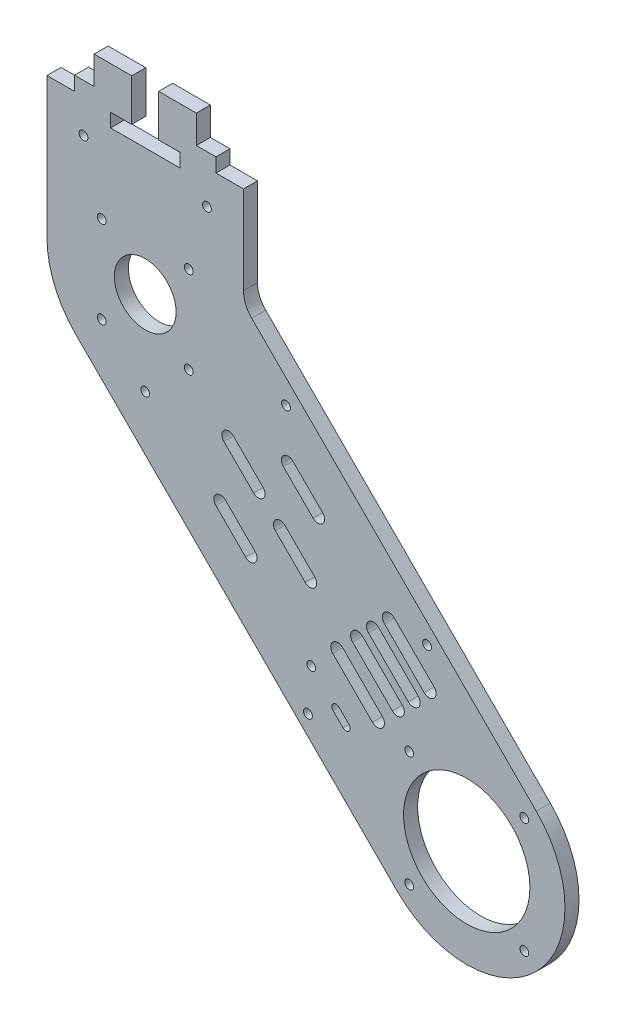
from build123d import *

# Parameters (mm, degrees)
SKETCH1_R           = 1.575
SKETCH1_R_2         = 22.5
SKETCH1_R_3         = 11
BOSS_EXTRUDE1_DEPTH = 5
SKETCH2_W           = 13.4
SKETCH2_H           = 5
BOSS_EXTRUDE2_DEPTH = 5


with BuildPart() as part:
    # Sketch1 → Boss-Extrude1 (new body)
    with BuildSketch(Plane.XY):
        with BuildLine():
            Line((-139.300035894, 89.802561211), (-24.748737342, -24.748737342))
            ThreePointArc((-24.748737342, -24.748737342), (24.748737342, -24.748737342), (24.748737342, 24.748737342))
            Line((24.748737342, 24.748737342), (-54.672802234, 104.170276917))
            Line((-54.672802234, 104.170276917), (-76.622366364, 126.119841047))
            ThreePointArc((-76.622366364, 126.119841047), (-78.790093877, 129.364074535), (-79.551298552, 133.190908859))
            Line((-79.551298552, 133.190908859), (-79.551298552, 164.551298552))
            Line((-79.551298552, 164.551298552), (-89.351298552, 164.551298552))
            Line((-89.351298552, 164.551298552), (-89.351298552, 169.551298552))
            Line((-89.351298552, 169.551298552), (-96.351298552, 169.551298552))
            Line((-96.351298552, 169.551298552), (-96.351298552, 174.551298552))
            Line((-96.351298552, 174.551298552), (-109.751298552, 174.551298552))
            Line((-109.751298552, 174.551298552), (-109.751298552, 169.551298552))
            Line((-109.751298552, 169.551298552), (-109.751298552, 164.551298552))
            Line((-109.751298552, 164.551298552), (-102.201298552, 164.551298552))
            Line((-102.201298552, 164.551298552), (-102.201298552, 159.701298552))
            Line((-102.201298552, 159.701298552), (-126.901298552, 159.701298552))
            Line((-126.901298552, 159.701298552), (-126.901298552, 164.551298552))
            Line((-126.901298552, 164.551298552), (-119.351298552, 164.551298552))
            Line((-119.351298552, 164.551298552), (-119.351298552, 169.551298552))
            Line((-119.351298552, 169.551298552), (-119.351298552, 174.551298552))
            Line((-119.351298552, 174.551298552), (-132.751298552, 174.551298552))
            Line((-132.751298552, 174.551298552), (-132.751298552, 169.551298552))
            Line((-132.751298552, 169.551298552), (-139.751298552, 169.551298552))
            Line((-139.751298552, 169.551298552), (-139.751298552, 164.551298552))
            Line((-139.751298552, 164.551298552), (-149.551298552, 164.551298552))
            Line((-149.551298552, 164.551298552), (-149.551298552, 114.551298552))
            ThreePointArc((-149.551298552, 114.551298552), (-146.88708219, 101.157378419), (-139.300035894, 89.802561211))
        make_face()
        with BuildLine():
            Line((-78.771695424, 51.335952314), (-89.378297142, 61.942554032))
            ThreePointArc((-89.378297142, 61.942554032), (-89.378297142, 65.336666582), (-85.984184592, 65.336666582))
            Line((-85.984184592, 65.336666582), (-75.377582874, 54.730064864))
            ThreePointArc((-75.377582874, 54.730064864), (-75.377582874, 51.335952314), (-78.771695424, 51.335952314))
        make_face(mode=Mode.SUBTRACT)
        with BuildLine():
            ThreePointArc((-68.165093707, 64.770981156), (-68.165093707, 68.165093706), (-64.770981157, 68.165093706))
            Line((-64.770981157, 68.165093706), (-54.164379439, 57.558491989))
            ThreePointArc((-54.164379439, 57.558491989), (-54.164379439, 54.164379439), (-57.558491988, 54.164379439))
            Line((-57.558491988, 54.164379439), (-68.165093707, 64.770981156))
        make_face(mode=Mode.SUBTRACT)
        with Locations((-20.506096654, -20.506096654)):
            Circle(SKETCH1_R, mode=Mode.SUBTRACT)
        with Locations((-56.568542495, 14.142135624)):
            Circle(SKETCH1_R, mode=Mode.SUBTRACT)
        with Locations((20.506096654, -20.506096654)):
            Circle(SKETCH1_R, mode=Mode.SUBTRACT)
        Circle(SKETCH1_R_2, mode=Mode.SUBTRACT)
        with Locations((-55.401816306, 29.450997436)):
            Circle(SKETCH1_R, mode=Mode.SUBTRACT)
        with BuildLine():
            ThreePointArc((-47.623641713, 19.5515025), (-47.623641713, 21.672822843), (-45.502321369, 21.672822843))
            Line((-45.502321369, 21.672822843), (-41.966787463, 18.137288937))
            ThreePointArc((-41.966787463, 18.137288937), (-41.966787463, 16.015968594), (-44.088107807, 16.015968594))
            Line((-44.088107807, 16.015968594), (-47.623641713, 19.5515025))
        make_face(mode=Mode.SUBTRACT)
        with BuildLine():
            ThreePointArc((-47.72970773, 37.123106012), (-47.72970773, 40.658639918), (-44.194173824, 40.658639918))
            Line((-44.194173824, 40.658639918), (-30.0520382, 26.516504294))
            ThreePointArc((-30.0520382, 26.516504294), (-30.0520382, 22.980970389), (-33.587572106, 22.980970389))
            Line((-33.587572106, 22.980970389), (-47.72970773, 37.123106012))
        make_face(mode=Mode.SUBTRACT)
        with Locations((-20.506096654, 20.506096654)):
            Circle(SKETCH1_R, mode=Mode.SUBTRACT)
        with BuildLine():
            ThreePointArc((-40.658639918, 44.194173824), (-40.658639918, 47.72970773), (-37.123106012, 47.72970773))
            Line((-37.123106012, 47.72970773), (-22.980970389, 33.587572106))
            ThreePointArc((-22.980970389, 33.587572106), (-22.980970389, 30.0520382), (-26.516504294, 30.0520382))
            Line((-26.516504294, 30.0520382), (-40.658639918, 44.194173824))
        make_face(mode=Mode.SUBTRACT)
        with BuildLine():
            ThreePointArc((-35.001785669, 49.851028074), (-35.001785669, 53.38656198), (-31.466251763, 53.38656198))
            Line((-31.466251763, 53.38656198), (-17.324116139, 39.244426356))
            ThreePointArc((-17.324116139, 39.244426356), (-17.324116139, 35.70889245), (-20.859650045, 35.70889245))
            Line((-20.859650045, 35.70889245), (-35.001785669, 49.851028074))
        make_face(mode=Mode.SUBTRACT)
        with BuildLine():
            ThreePointArc((-29.344931419, 55.507882323), (-29.344931419, 59.043416229), (-25.809397513, 59.043416229))
            Line((-25.809397513, 59.043416229), (-11.66726189, 44.901280605))
            ThreePointArc((-11.66726189, 44.901280605), (-11.66726189, 41.365746699), (-15.202795796, 41.365746699))
            Line((-15.202795796, 41.365746699), (-29.344931419, 55.507882323))
        make_face(mode=Mode.SUBTRACT)
        with Locations((-14.142135624, 56.568542495)):
            Circle(SKETCH1_R, mode=Mode.SUBTRACT)
        with Locations((20.506096654, 20.506096654)):
            Circle(SKETCH1_R, mode=Mode.SUBTRACT)
        with Locations((-114.551298552, 84.551298552)):
            Circle(SKETCH1_R, mode=Mode.SUBTRACT)
        with Locations((-130.051298552, 99.051298552)):
            Circle(SKETCH1_R, mode=Mode.SUBTRACT)
        with Locations((-114.551298552, 114.551298552)):
            Circle(SKETCH1_R_3, mode=Mode.SUBTRACT)
        with BuildLine():
            ThreePointArc((-86.549870017, 83.155757468), (-86.549870017, 86.549870017), (-83.155757468, 86.549870017))
            Line((-83.155757468, 86.549870017), (-72.54915575, 75.943268299))
            ThreePointArc((-72.54915575, 75.943268299), (-72.54915575, 72.54915575), (-75.943268299, 72.54915575))
            Line((-75.943268299, 72.54915575), (-86.549870017, 83.155757468))
        make_face(mode=Mode.SUBTRACT)
        with BuildLine():
            ThreePointArc((-65.336666582, 85.984184592), (-65.336666582, 89.378297142), (-61.942554032, 89.378297142))
            Line((-61.942554032, 89.378297142), (-51.335952314, 78.771695424))
            ThreePointArc((-51.335952314, 78.771695424), (-51.335952314, 75.377582874), (-54.730064864, 75.377582874))
            Line((-54.730064864, 75.377582874), (-65.336666582, 85.984184592))
        make_face(mode=Mode.SUBTRACT)
        with Locations((-99.051298552, 99.051298552)):
            Circle(SKETCH1_R, mode=Mode.SUBTRACT)
        with Locations((-64.396887007, 105.308740477)):
            Circle(SKETCH1_R, mode=Mode.SUBTRACT)
        with Locations((-130.051298552, 130.051298552)):
            Circle(SKETCH1_R, mode=Mode.SUBTRACT)
        with Locations((-136.551298552, 152.551298552)):
            Circle(SKETCH1_R, mode=Mode.SUBTRACT)
        with Locations((-99.051298552, 130.051298552)):
            Circle(SKETCH1_R, mode=Mode.SUBTRACT)
        with Locations((-92.551298552, 152.551298552)):
            Circle(SKETCH1_R, mode=Mode.SUBTRACT)
    extrude(amount=-BOSS_EXTRUDE1_DEPTH)

    # Sketch2 → Boss-Extrude2 (add)
    with BuildSketch(Plane.XY):
        with Locations((-126.051298552, 177.051298552)):
            Rectangle(SKETCH2_W, SKETCH2_H)
        with Locations((-103.051298552, 177.051298552)):
            Rectangle(SKETCH2_W, SKETCH2_H)
    extrude(amount=-BOSS_EXTRUDE2_DEPTH)


solid = part.part
